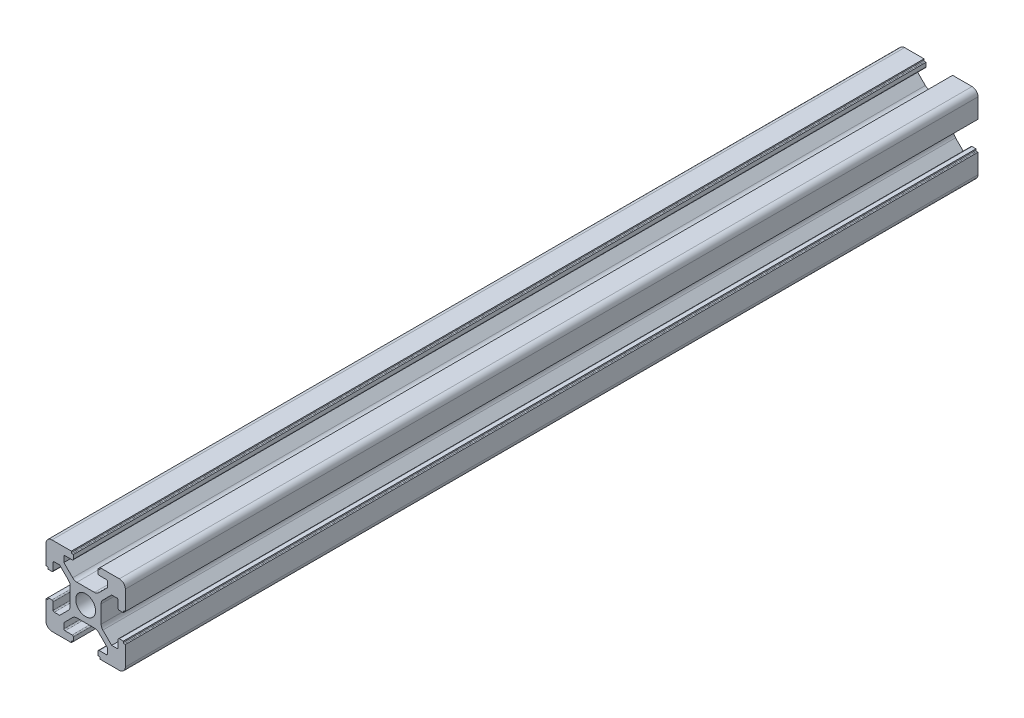
from build123d import *

# Parameters (mm, degrees)
SKETCH_1_R      = 2.5
EXTRUDE_1_DEPTH = 215


with BuildPart() as part:
    # 草图1 → 凸台-拉伸1 (new body)
    with BuildSketch(Plane.XY):
        with BuildLine():
            Line((4.215995631, 3.244230202), (6.436655803, 5.464890373))
            Line((6.436655803, 5.464890373), (7.776655803, 5.464890373))
            ThreePointArc((7.776655803, 5.464890373), (7.988787838, 5.377022408), (8.076655803, 5.164890373))
            Line((8.076655803, 5.164890373), (8.076655803, 3.364890373))
            ThreePointArc((8.076655803, 3.364890373), (8.164523769, 3.152758339), (8.376655803, 3.064890373))
            Line((8.376655803, 3.064890373), (9.376655803, 3.064890373))
            Line((9.376655803, 3.064890373), (9.376655803, 3.364890373))
            ThreePointArc((9.376655803, 3.364890373), (9.435234447, 3.50631173), (9.576655803, 3.564890373))
            Line((9.576655803, 3.564890373), (9.876655803, 3.564890373))
            Line((9.876655803, 3.564890373), (9.876655803, 8.464890373))
            ThreePointArc((9.876655803, 8.464890373), (9.437315975, 9.525550545), (8.376655803, 9.964890373))
            Line((8.376655803, 9.964890373), (3.476655803, 9.964890373))
            Line((3.476655803, 9.964890373), (3.476655803, 9.664890373))
            ThreePointArc((3.476655803, 9.664890373), (3.418077159, 9.523469017), (3.276655803, 9.464890373))
            Line((3.276655803, 9.464890373), (2.976655803, 9.464890373))
            Line((2.976655803, 9.464890373), (2.976655803, 8.464890373))
            ThreePointArc((2.976655803, 8.464890373), (3.064523769, 8.252758339), (3.276655803, 8.164890373))
            Line((3.276655803, 8.164890373), (5.076655803, 8.164890373))
            ThreePointArc((5.076655803, 8.164890373), (5.288787838, 8.077022408), (5.376655803, 7.864890373))
            Line((5.376655803, 7.864890373), (5.376655803, 6.524890373))
            Line((5.376655803, 6.524890373), (3.155995631, 4.304230202))
            ThreePointArc((3.155995631, 4.304230202), (2.669360608, 3.979071075), (2.09533546, 3.864890373))
            Line((2.09533546, 3.864890373), (-2.342023853, 3.864890373))
            ThreePointArc((-2.342023853, 3.864890373), (-2.916049002, 3.979071075), (-3.402684025, 4.304230202))
            Line((-3.402684025, 4.304230202), (-5.623344197, 6.524890373))
            Line((-5.623344197, 6.524890373), (-5.623344197, 7.864890373))
            ThreePointArc((-5.623344197, 7.864890373), (-5.535476231, 8.077022408), (-5.323344197, 8.164890373))
            Line((-5.323344197, 8.164890373), (-3.523344197, 8.164890373))
            ThreePointArc((-3.523344197, 8.164890373), (-3.311212162, 8.252758339), (-3.223344197, 8.464890373))
            Line((-3.223344197, 8.464890373), (-3.223344197, 9.464890373))
            Line((-3.223344197, 9.464890373), (-3.523344197, 9.464890373))
            ThreePointArc((-3.523344197, 9.464890373), (-3.664765553, 9.523469017), (-3.723344197, 9.664890373))
            Line((-3.723344197, 9.664890373), (-3.723344197, 9.964890373))
            Line((-3.723344197, 9.964890373), (-8.623344197, 9.964890373))
            ThreePointArc((-8.623344197, 9.964890373), (-9.684004369, 9.525550545), (-10.123344197, 8.464890373))
            Line((-10.123344197, 8.464890373), (-10.123344197, 3.564890373))
            Line((-10.123344197, 3.564890373), (-9.823344197, 3.564890373))
            ThreePointArc((-9.823344197, 3.564890373), (-9.681922841, 3.50631173), (-9.623344197, 3.364890373))
            Line((-9.623344197, 3.364890373), (-9.623344197, 3.064890373))
            Line((-9.623344197, 3.064890373), (-8.623344197, 3.064890373))
            ThreePointArc((-8.623344197, 3.064890373), (-8.411212162, 3.152758339), (-8.323344197, 3.364890373))
            Line((-8.323344197, 3.364890373), (-8.323344197, 5.164890373))
            ThreePointArc((-8.323344197, 5.164890373), (-8.235476231, 5.377022408), (-8.023344197, 5.464890373))
            Line((-8.023344197, 5.464890373), (-6.683344197, 5.464890373))
            Line((-6.683344197, 5.464890373), (-4.462684025, 3.244230202))
            ThreePointArc((-4.462684025, 3.244230202), (-4.137524898, 2.757595178), (-4.023344197, 2.18357003))
            Line((-4.023344197, 2.18357003), (-4.023344197, -2.253789283))
            ThreePointArc((-4.023344197, -2.253789283), (-4.137524898, -2.827814432), (-4.462684025, -3.314449455))
            Line((-4.462684025, -3.314449455), (-6.683344197, -5.535109627))
            Line((-6.683344197, -5.535109627), (-8.023344197, -5.535109627))
            ThreePointArc((-8.023344197, -5.535109627), (-8.235476231, -5.447241661), (-8.323344197, -5.235109627))
            Line((-8.323344197, -5.235109627), (-8.323344197, -3.435109627))
            ThreePointArc((-8.323344197, -3.435109627), (-8.411212162, -3.222977592), (-8.623344197, -3.135109627))
            Line((-8.623344197, -3.135109627), (-9.623344197, -3.135109627))
            Line((-9.623344197, -3.135109627), (-9.623344197, -3.435109627))
            ThreePointArc((-9.623344197, -3.435109627), (-9.681922841, -3.576530983), (-9.823344197, -3.635109627))
            Line((-9.823344197, -3.635109627), (-10.123344197, -3.635109627))
            Line((-10.123344197, -3.635109627), (-10.123344197, -8.535109627))
            ThreePointArc((-10.123344197, -8.535109627), (-9.684004369, -9.595769798), (-8.623344197, -10.035109627))
            Line((-8.623344197, -10.035109627), (-3.723344197, -10.035109627))
            Line((-3.723344197, -10.035109627), (-3.723344197, -9.735109627))
            ThreePointArc((-3.723344197, -9.735109627), (-3.664765553, -9.59368827), (-3.523344197, -9.535109627))
            Line((-3.523344197, -9.535109627), (-3.223344197, -9.535109627))
            Line((-3.223344197, -9.535109627), (-3.223344197, -8.535109627))
            ThreePointArc((-3.223344197, -8.535109627), (-3.311212162, -8.322977592), (-3.523344197, -8.235109627))
            Line((-3.523344197, -8.235109627), (-5.323344197, -8.235109627))
            ThreePointArc((-5.323344197, -8.235109627), (-5.535476231, -8.147241661), (-5.623344197, -7.935109627))
            Line((-5.623344197, -7.935109627), (-5.623344197, -6.595109627))
            Line((-5.623344197, -6.595109627), (-3.402684025, -4.374449455))
            ThreePointArc((-3.402684025, -4.374449455), (-2.916049002, -4.049290328), (-2.342023853, -3.935109627))
            Line((-2.342023853, -3.935109627), (2.09533546, -3.935109627))
            ThreePointArc((2.09533546, -3.935109627), (2.669360608, -4.049290328), (3.155995631, -4.374449455))
            Line((3.155995631, -4.374449455), (5.376655803, -6.595109627))
            Line((5.376655803, -6.595109627), (5.376655803, -7.935109627))
            ThreePointArc((5.376655803, -7.935109627), (5.288787838, -8.147241661), (5.076655803, -8.235109627))
            Line((5.076655803, -8.235109627), (3.276655803, -8.235109627))
            ThreePointArc((3.276655803, -8.235109627), (3.064523769, -8.322977592), (2.976655803, -8.535109627))
            Line((2.976655803, -8.535109627), (2.976655803, -9.535109627))
            Line((2.976655803, -9.535109627), (3.276655803, -9.535109627))
            ThreePointArc((3.276655803, -9.535109627), (3.418077159, -9.59368827), (3.476655803, -9.735109627))
            Line((3.476655803, -9.735109627), (3.476655803, -10.035109627))
            Line((3.476655803, -10.035109627), (8.376655803, -10.035109627))
            ThreePointArc((8.376655803, -10.035109627), (9.437315975, -9.595769798), (9.876655803, -8.535109627))
            Line((9.876655803, -8.535109627), (9.876655803, -3.635109627))
            Line((9.876655803, -3.635109627), (9.576655803, -3.635109627))
            ThreePointArc((9.576655803, -3.635109627), (9.435234447, -3.576530983), (9.376655803, -3.435109627))
            Line((9.376655803, -3.435109627), (9.376655803, -3.135109627))
            Line((9.376655803, -3.135109627), (8.376655803, -3.135109627))
            ThreePointArc((8.376655803, -3.135109627), (8.164523769, -3.222977592), (8.076655803, -3.435109627))
            Line((8.076655803, -3.435109627), (8.076655803, -5.235109627))
            ThreePointArc((8.076655803, -5.235109627), (7.988787838, -5.447241661), (7.776655803, -5.535109627))
            Line((7.776655803, -5.535109627), (6.436655803, -5.535109627))
            Line((6.436655803, -5.535109627), (4.215995631, -3.314449455))
            ThreePointArc((4.215995631, -3.314449455), (3.890836504, -2.827814432), (3.776655803, -2.253789283))
            Line((3.776655803, -2.253789283), (3.776655803, 2.18357003))
            ThreePointArc((3.776655803, 2.18357003), (3.890836504, 2.757595178), (4.215995631, 3.244230202))
        make_face()
        with Locations((-0.123344197, -0.035109627)):
            Circle(SKETCH_1_R, mode=Mode.SUBTRACT)
    extrude(amount=EXTRUDE_1_DEPTH)


solid = part.part
